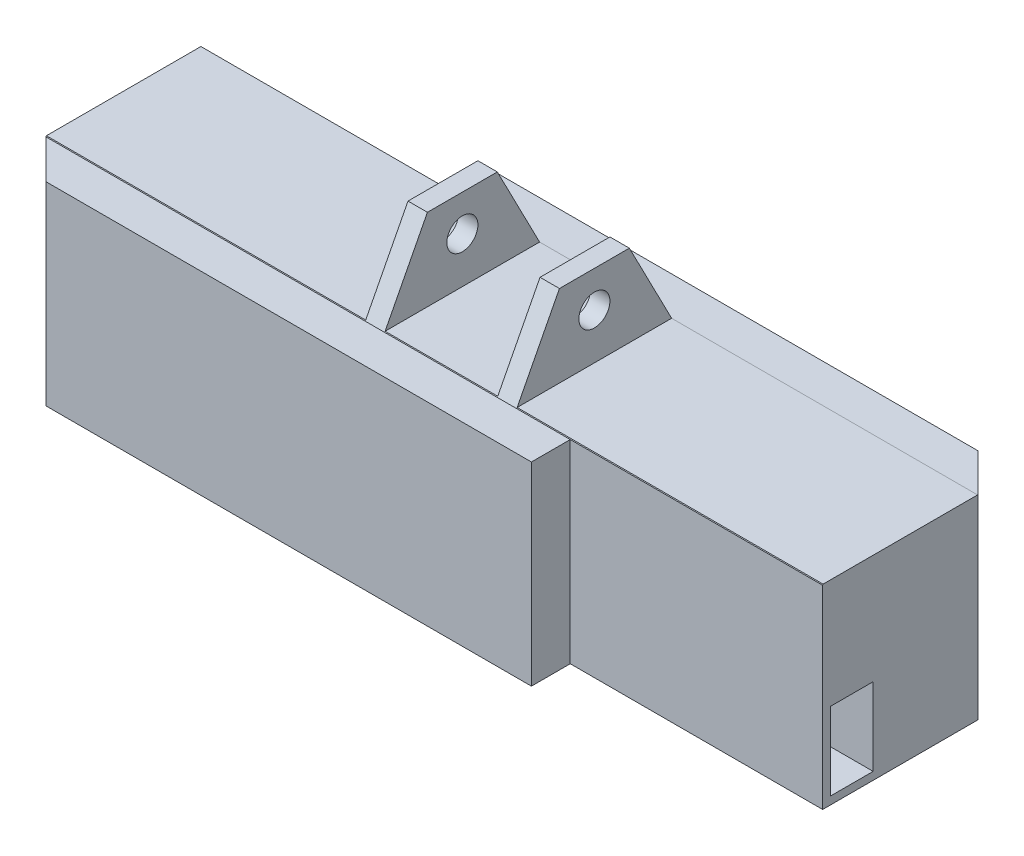
from build123d import *

# Parameters (mm, degrees)
BOSS_EXTRUDE1_DEPTH = 1270
SKETCH2_W           = 279.4
SKETCH2_H           = 508
CUT_EXTRUDE1_DEPTH  = 3048
SKETCH4_W           = 279.4
SKETCH4_H           = 508
CUT_EXTRUDE2_DEPTH  = 3048
SKETCH5_R           = 101.6
BOSS_EXTRUDE2_DEPTH = 5080
CUT_EXTRUDE3_REACH  = 5606.319
SKETCH6_W           = 2088.330697782
SKETCH6_H           = 535.563960187
SKETCH6_W_2         = 2001.069302218
SKETCH6_W_3         = 736.6


with BuildPart() as part:
    # Sketch1 → Boss-Extrude1 (new body)
    with BuildSketch(Plane(origin=(0, 0, 0), x_dir=(1, 0, 0), z_dir=(0, 1, 0))):
        Polygon((0, 254), (254, 0), (3429, 0), (3429, 254), (5080, 254), (5080, 1270), (4826, 1524), (1651, 1524), (1651, 1270), (0, 1270), align=None)
    extrude(amount=BOSS_EXTRUDE1_DEPTH)

    # Sketch2 → Cut-Extrude1 (cut)
    with BuildSketch(Plane(origin=(5080, 0, 0), x_dir=(0, 0, -1), z_dir=(1, 0, 0))):
        with Locations((444.5, 304.8)):
            Rectangle(SKETCH2_W, SKETCH2_H)
    extrude(amount=-CUT_EXTRUDE1_DEPTH, mode=Mode.SUBTRACT)

    # Sketch4 → Cut-Extrude2 (cut)
    with BuildSketch(Plane.ZY):
        with Locations((-1079.5, 304.8)):
            Rectangle(SKETCH4_W, SKETCH4_H)
    extrude(amount=-CUT_EXTRUDE2_DEPTH, mode=Mode.SUBTRACT)

    # Sketch5 → Boss-Extrude2 (add, through all)
    with BuildSketch(Plane(origin=(5080, 0, 0), x_dir=(0, 0, -1), z_dir=(1, 0, 0))):
        Polygon((254, 1270), (533.4, 1810.916704273), (990.6, 1810.916704273), (1270, 1270), align=None)
        with Locations((762, 1574.8)):
            Circle(SKETCH5_R, mode=Mode.SUBTRACT)
    extrude(amount=-BOSS_EXTRUDE2_DEPTH)

    # Cut-Extrude3: up to this plane
    cut_extrude3_end = Plane(origin=(0, 1270, -1270), z_dir=(0, 0.45892459056390483, -0.888475222038157))
    # Sketch6 → Cut-Extrude3 (cut, up to the surface)
    with BuildSketch(Plane.XY, mode=Mode.PRIVATE) as cut_extrude3_sk1:
        with Locations((1044.165348891, 1543.13472418)):
            Rectangle(SKETCH6_W, SKETCH6_H)
    cut_extrude3_tool1 = split(extrude(cut_extrude3_sk1.sketch, amount=-CUT_EXTRUDE3_REACH, mode=Mode.PRIVATE), bisect_by=cut_extrude3_end, keep=Keep.BOTH, mode=Mode.PRIVATE)
    add(cut_extrude3_tool1.solids().sort_by_distance((1044.165349, 1543.134724, 0))[0], mode=Mode.SUBTRACT)
    # Sketch6 → Cut-Extrude3 (cut, up to the surface)
    with BuildSketch(Plane.XY, mode=Mode.PRIVATE) as cut_extrude3_sk2:
        with Locations((4079.465348891, 1543.13472418)):
            Rectangle(SKETCH6_W_2, SKETCH6_H)
    cut_extrude3_tool2 = split(extrude(cut_extrude3_sk2.sketch, amount=-CUT_EXTRUDE3_REACH, mode=Mode.PRIVATE), bisect_by=cut_extrude3_end, keep=Keep.BOTH, mode=Mode.PRIVATE)
    add(cut_extrude3_tool2.solids().sort_by_distance((4079.465349, 1543.134724, 0))[0], mode=Mode.SUBTRACT)
    # Sketch6 → Cut-Extrude3 (cut, up to the surface)
    with BuildSketch(Plane.XY, mode=Mode.PRIVATE) as cut_extrude3_sk3:
        with Locations((2583.630697782, 1543.13472418)):
            Rectangle(SKETCH6_W_3, SKETCH6_H)
    cut_extrude3_tool3 = split(extrude(cut_extrude3_sk3.sketch, amount=-CUT_EXTRUDE3_REACH, mode=Mode.PRIVATE), bisect_by=cut_extrude3_end, keep=Keep.BOTH, mode=Mode.PRIVATE)
    add(cut_extrude3_tool3.solids().sort_by_distance((2583.630698, 1543.134724, 0))[0], mode=Mode.SUBTRACT)


solid = part.part
